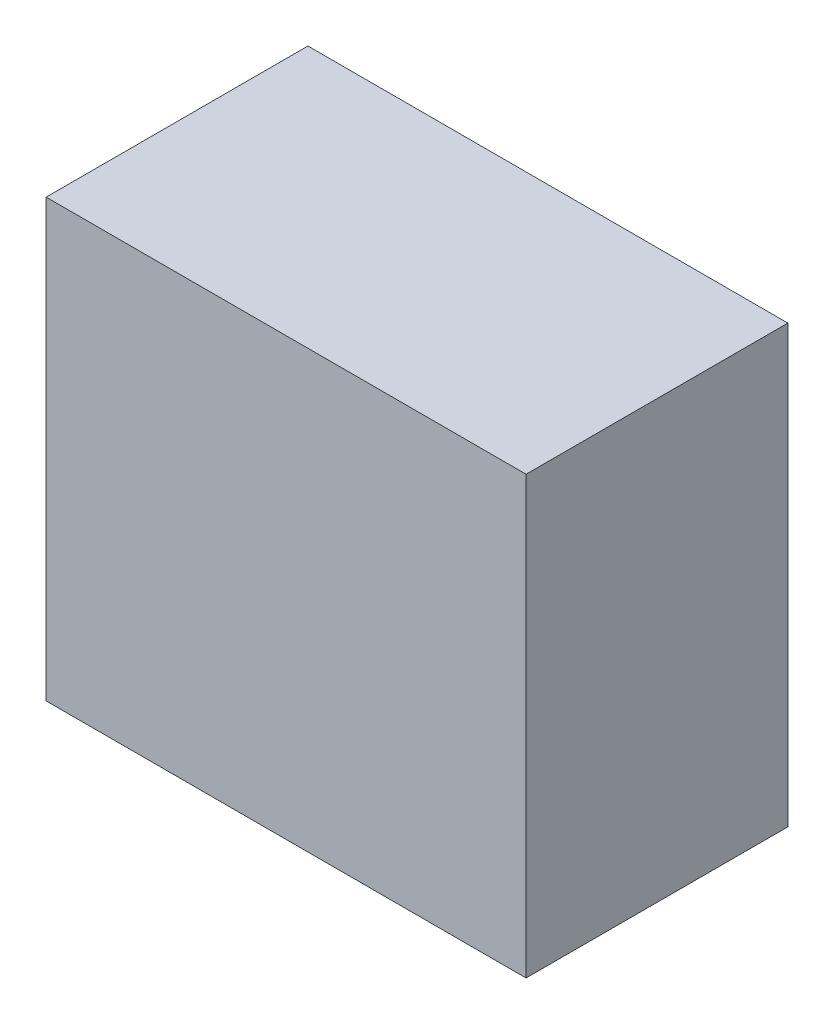
from build123d import *

# Parameters (mm, degrees)
CROQUIS1_W              = 110
CROQUIS1_H              = 100
SALIENTE_EXTRUIR1_DEPTH = 30


with BuildPart() as part:
    # Croquis1 → Saliente-Extruir1 (new, symmetric)
    with BuildSketch(Plane.XY):
        Rectangle(CROQUIS1_W, CROQUIS1_H)
    extrude(amount=SALIENTE_EXTRUIR1_DEPTH, both=True)


solid = part.part
